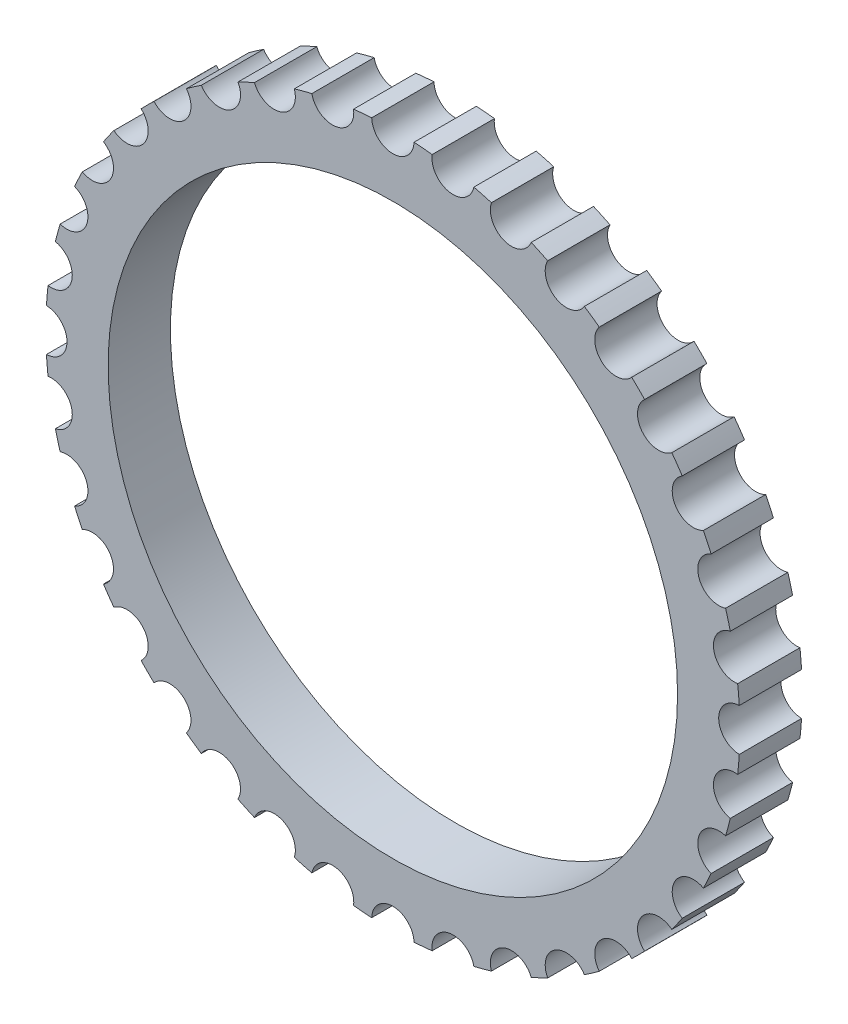
from build123d import *

# Parameters (mm, degrees)
SKETCH1_R           = 27.852115
SKETCH1_R_2         = 22.852115
BOSS_EXTRUDE1_DEPTH = 5
SKETCH3_R           = 1.7
CUT_EXTRUDE1_DEPTH  = 8


with BuildPart() as part:
    # Sketch1 → Boss-Extrude1 (new body)
    with BuildSketch(Plane.XY):
        Circle(SKETCH1_R)
        Circle(SKETCH1_R_2, mode=Mode.SUBTRACT)
    extrude(amount=BOSS_EXTRUDE1_DEPTH)

    # Sketch3 → Cut-Extrude1 (cut, symmetric)
    with BuildSketch(Plane.XY.offset(2.5)):
        with Locations((27.852115, 0)):
            Circle(SKETCH3_R)
        with Locations((27.42897879, -4.836469014)):
            Circle(SKETCH3_R)
        with Locations((26.172426939, -9.525984364)):
            Circle(SKETCH3_R)
        with Locations((24.120639139, -13.9260575)):
            Circle(SKETCH3_R)
        with Locations((21.335957925, -17.902994426)):
            Circle(SKETCH3_R)
        with Locations((17.902994426, -21.335957925)):
            Circle(SKETCH3_R)
        with Locations((13.9260575, -24.120639139)):
            Circle(SKETCH3_R)
        with Locations((9.525984364, -26.172426939)):
            Circle(SKETCH3_R)
        with Locations((4.836469014, -27.42897879)):
            Circle(SKETCH3_R)
        with Locations((0, -27.852115)):
            Circle(SKETCH3_R)
        with Locations((-4.836469014, -27.42897879)):
            Circle(SKETCH3_R)
        with Locations((-9.525984364, -26.172426939)):
            Circle(SKETCH3_R)
        with Locations((-13.9260575, -24.120639139)):
            Circle(SKETCH3_R)
        with Locations((-17.902994426, -21.335957925)):
            Circle(SKETCH3_R)
        with Locations((-21.335957925, -17.902994426)):
            Circle(SKETCH3_R)
        with Locations((-24.120639139, -13.9260575)):
            Circle(SKETCH3_R)
        with Locations((-26.172426939, -9.525984364)):
            Circle(SKETCH3_R)
        with Locations((-27.42897879, -4.836469014)):
            Circle(SKETCH3_R)
        with Locations((-27.852115, 0)):
            Circle(SKETCH3_R)
        with Locations((-27.42897879, 4.836469014)):
            Circle(SKETCH3_R)
        with Locations((-26.172426939, 9.525984364)):
            Circle(SKETCH3_R)
        with Locations((-24.120639139, 13.9260575)):
            Circle(SKETCH3_R)
        with Locations((-21.335957925, 17.902994426)):
            Circle(SKETCH3_R)
        with Locations((-17.902994426, 21.335957925)):
            Circle(SKETCH3_R)
        with Locations((-13.9260575, 24.120639139)):
            Circle(SKETCH3_R)
        with Locations((-9.525984364, 26.172426939)):
            Circle(SKETCH3_R)
        with Locations((-4.836469014, 27.42897879)):
            Circle(SKETCH3_R)
        with Locations((0, 27.852115)):
            Circle(SKETCH3_R)
        with Locations((4.836469014, 27.42897879)):
            Circle(SKETCH3_R)
        with Locations((9.525984364, 26.172426939)):
            Circle(SKETCH3_R)
        with Locations((13.9260575, 24.120639139)):
            Circle(SKETCH3_R)
        with Locations((17.902994426, 21.335957925)):
            Circle(SKETCH3_R)
        with Locations((21.335957925, 17.902994426)):
            Circle(SKETCH3_R)
        with Locations((24.120639139, 13.9260575)):
            Circle(SKETCH3_R)
        with Locations((26.172426939, 9.525984364)):
            Circle(SKETCH3_R)
        with Locations((27.42897879, 4.836469014)):
            Circle(SKETCH3_R)
    extrude(amount=CUT_EXTRUDE1_DEPTH, both=True, mode=Mode.SUBTRACT)


solid = part.part
